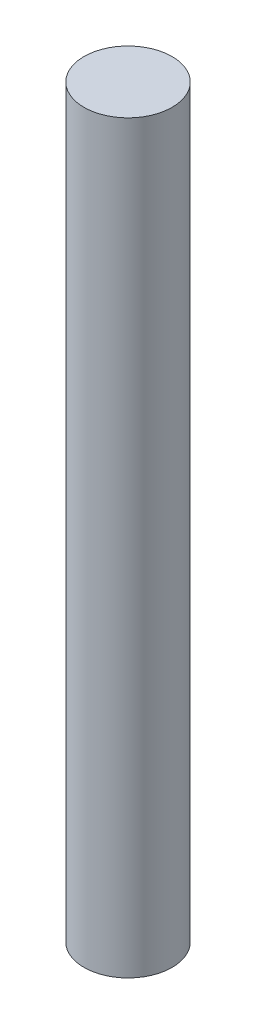
from build123d import *

# Parameters (mm, degrees)
SKETCH1_R           = 3.175
BOSS_EXTRUDE1_DEPTH = 53.7


with BuildPart() as part:
    # Sketch1 → Boss-Extrude1 (new body)
    with BuildSketch(Plane(origin=(0, 0, 0), x_dir=(1, 0, 0), z_dir=(0, 1, 0))):
        with Locations(Location((0, 0, 0), (0, 0, 90))):
            Circle(SKETCH1_R)
    extrude(amount=BOSS_EXTRUDE1_DEPTH)


solid = part.part
